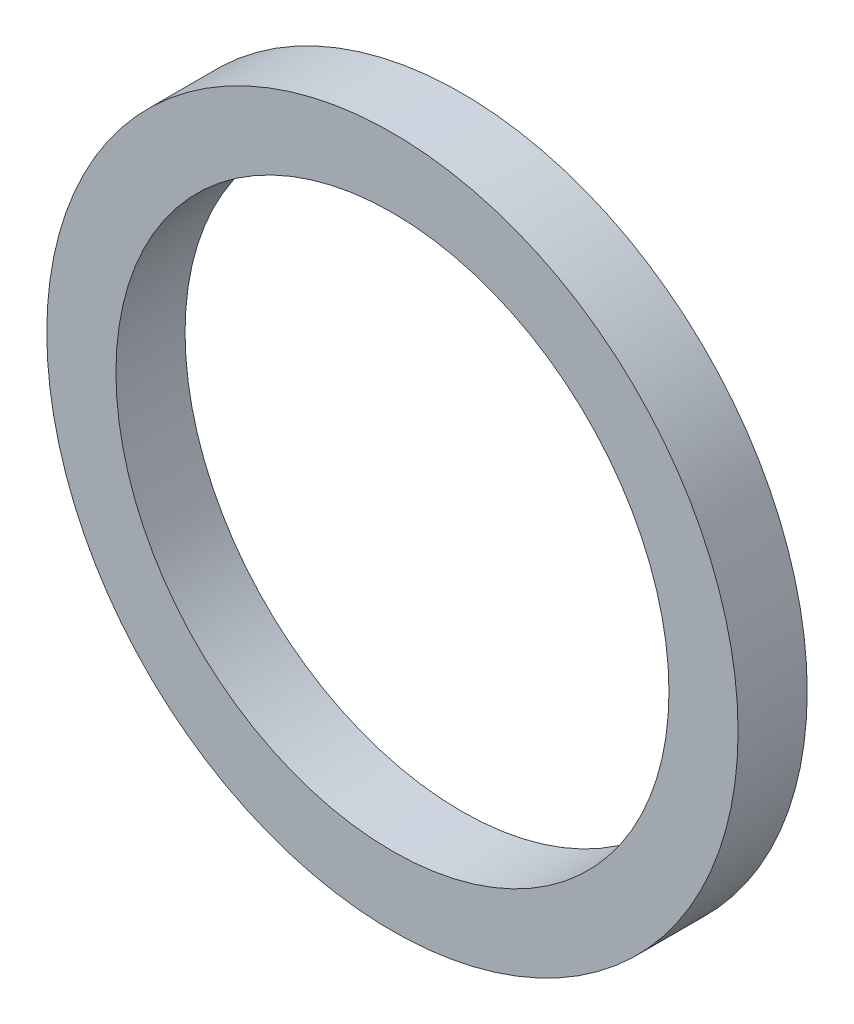
from build123d import *

# Parameters (mm, degrees)
SKETCH1_R           = 75
SKETCH1_R_2         = 60
BOSS_EXTRUDE1_DEPTH = 15


with BuildPart() as part:
    # Sketch1 → Boss-Extrude1 (new body)
    with BuildSketch(Plane.XY):
        Circle(SKETCH1_R)
        Circle(SKETCH1_R_2, mode=Mode.SUBTRACT)
    extrude(amount=BOSS_EXTRUDE1_DEPTH)


solid = part.part
